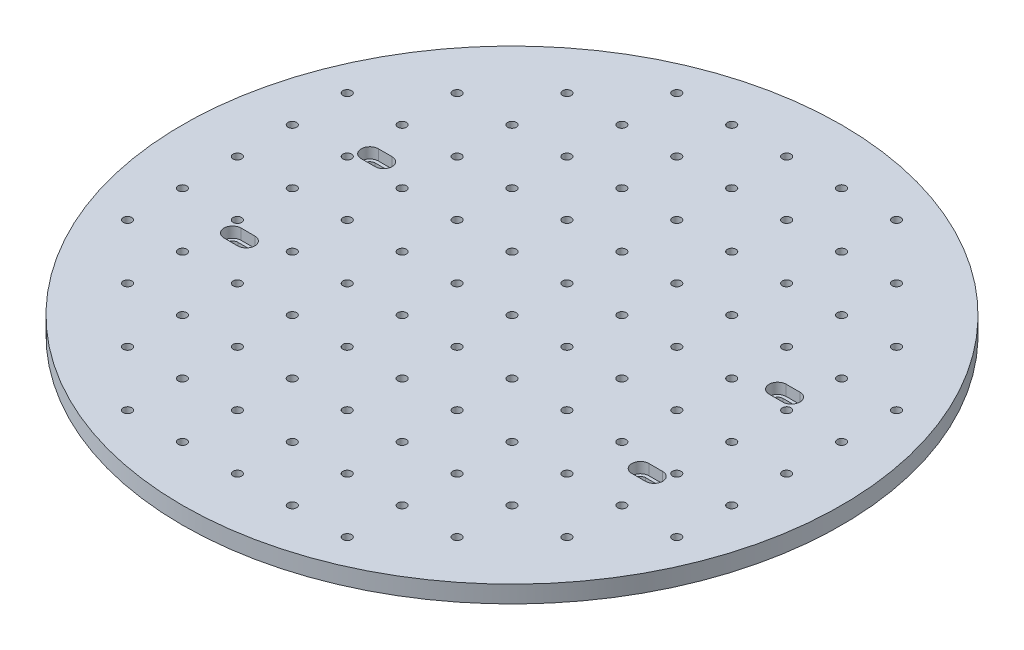
from build123d import *

# Parameters (mm, degrees)
SKETCH1_R      = 304.8
EXTRUDE1_DEPTH = 15.875
SKETCH2_R      = 3.96875
EXTRUDE2_DEPTH = 432.344520801
EXTRUDE3_DEPTH = 15.875
EXTRUDE4_DEPTH = 9.8298


with BuildPart() as part:
    # Sketch1 → Extrude1 (new body)
    with BuildSketch(Plane(origin=(0, 0, 0), x_dir=(1, 0, 0), z_dir=(0, 1, 0))):
        with Locations(Location((0, 0, 0), (0, 0, 270))):
            Circle(SKETCH1_R)
    extrude(amount=EXTRUDE1_DEPTH)

    # Sketch2 → Extrude2 (cut, through all)
    with BuildSketch(Plane(origin=(0, 15.875, 0), x_dir=(1, 0, 0), z_dir=(0, 1, 0))):
        with Locations(Location((-101.6, -254, 0), (0, 0, 270))):
            Circle(SKETCH2_R)
        with Locations(Location((-50.8, -254, 0), (0, 0, 270))):
            Circle(SKETCH2_R)
        with Locations(Location((0, -254, 0), (0, 0, 270))):
            Circle(SKETCH2_R)
        with Locations(Location((50.8, -254, 0), (0, 0, 270))):
            Circle(SKETCH2_R)
        with Locations(Location((101.6, -254, 0), (0, 0, 270))):
            Circle(SKETCH2_R)
        with Locations(Location((-152.4, -203.2, 0), (0, 0, 270))):
            Circle(SKETCH2_R)
        with Locations(Location((-101.6, -203.2, 0), (0, 0, 270))):
            Circle(SKETCH2_R)
        with Locations(Location((-50.8, -203.2, 0), (0, 0, 270))):
            Circle(SKETCH2_R)
        with Locations(Location((0, -203.2, 0), (0, 0, 270))):
            Circle(SKETCH2_R)
        with Locations(Location((50.8, -203.2, 0), (0, 0, 270))):
            Circle(SKETCH2_R)
        with Locations(Location((101.6, -203.2, 0), (0, 0, 270))):
            Circle(SKETCH2_R)
        with Locations(Location((152.4, -203.2, 0), (0, 0, 270))):
            Circle(SKETCH2_R)
        with Locations(Location((-203.2, -152.4, 0), (0, 0, 270))):
            Circle(SKETCH2_R)
        with Locations(Location((-152.4, -152.4, 0), (0, 0, 270))):
            Circle(SKETCH2_R)
        with Locations(Location((-101.6, -152.4, 0), (0, 0, 270))):
            Circle(SKETCH2_R)
        with Locations(Location((-50.8, -152.4, 0), (0, 0, 270))):
            Circle(SKETCH2_R)
        with Locations(Location((0, -152.4, 0), (0, 0, 270))):
            Circle(SKETCH2_R)
        with Locations(Location((50.8, -152.4, 0), (0, 0, 270))):
            Circle(SKETCH2_R)
        with Locations(Location((101.6, -152.4, 0), (0, 0, 270))):
            Circle(SKETCH2_R)
        with Locations(Location((152.4, -152.4, 0), (0, 0, 270))):
            Circle(SKETCH2_R)
        with Locations(Location((203.2, -152.4, 0), (0, 0, 270))):
            Circle(SKETCH2_R)
        with Locations(Location((-254, -101.6, 0), (0, 0, 270))):
            Circle(SKETCH2_R)
        with Locations(Location((-203.2, -101.6, 0), (0, 0, 270))):
            Circle(SKETCH2_R)
        with Locations(Location((-152.4, -101.6, 0), (0, 0, 270))):
            Circle(SKETCH2_R)
        with Locations(Location((-101.6, -101.6, 0), (0, 0, 270))):
            Circle(SKETCH2_R)
        with Locations(Location((-50.8, -101.6, 0), (0, 0, 270))):
            Circle(SKETCH2_R)
        with Locations(Location((0, -101.6, 0), (0, 0, 270))):
            Circle(SKETCH2_R)
        with Locations(Location((50.8, -101.6, 0), (0, 0, 270))):
            Circle(SKETCH2_R)
        with Locations(Location((101.6, -101.6, 0), (0, 0, 270))):
            Circle(SKETCH2_R)
        with Locations(Location((152.4, -101.6, 0), (0, 0, 270))):
            Circle(SKETCH2_R)
        with Locations(Location((203.2, -101.6, 0), (0, 0, 270))):
            Circle(SKETCH2_R)
        with Locations(Location((254, -101.6, 0), (0, 0, 270))):
            Circle(SKETCH2_R)
        with Locations(Location((-254, -50.8, 0), (0, 0, 270))):
            Circle(SKETCH2_R)
        with Locations(Location((-203.2, -50.8, 0), (0, 0, 270))):
            Circle(SKETCH2_R)
        with Locations(Location((-152.4, -50.8, 0), (0, 0, 270))):
            Circle(SKETCH2_R)
        with Locations(Location((-101.6, -50.8, 0), (0, 0, 270))):
            Circle(SKETCH2_R)
        with Locations(Location((-50.8, -50.8, 0), (0, 0, 270))):
            Circle(SKETCH2_R)
        with Locations(Location((0, -50.8, 0), (0, 0, 270))):
            Circle(SKETCH2_R)
        with Locations(Location((50.8, -50.8, 0), (0, 0, 270))):
            Circle(SKETCH2_R)
        with Locations(Location((101.6, -50.8, 0), (0, 0, 270))):
            Circle(SKETCH2_R)
        with Locations(Location((152.4, -50.8, 0), (0, 0, 270))):
            Circle(SKETCH2_R)
        with Locations(Location((203.2, -50.8, 0), (0, 0, 270))):
            Circle(SKETCH2_R)
        with Locations(Location((254, -50.8, 0), (0, 0, 270))):
            Circle(SKETCH2_R)
        with Locations(Location((-254, 0, 0), (0, 0, 270))):
            Circle(SKETCH2_R)
        with Locations(Location((-203.2, 0, 0), (0, 0, 270))):
            Circle(SKETCH2_R)
        with Locations(Location((-152.4, 0, 0), (0, 0, 270))):
            Circle(SKETCH2_R)
        with Locations(Location((-101.6, 0, 0), (0, 0, 270))):
            Circle(SKETCH2_R)
        with Locations(Location((-50.8, 0, 0), (0, 0, 270))):
            Circle(SKETCH2_R)
        with Locations(Location((0, 0, 0), (0, 0, 270))):
            Circle(SKETCH2_R)
        with Locations(Location((50.8, 0, 0), (0, 0, 270))):
            Circle(SKETCH2_R)
        with Locations(Location((101.6, 0, 0), (0, 0, 270))):
            Circle(SKETCH2_R)
        with Locations(Location((152.4, 0, 0), (0, 0, 270))):
            Circle(SKETCH2_R)
        with Locations(Location((203.2, 0, 0), (0, 0, 270))):
            Circle(SKETCH2_R)
        with Locations(Location((254, 0, 0), (0, 0, 270))):
            Circle(SKETCH2_R)
        with Locations(Location((-254, 50.8, 0), (0, 0, 270))):
            Circle(SKETCH2_R)
        with Locations(Location((-203.2, 50.8, 0), (0, 0, 270))):
            Circle(SKETCH2_R)
        with Locations(Location((-152.4, 50.8, 0), (0, 0, 270))):
            Circle(SKETCH2_R)
        with Locations(Location((-101.6, 50.8, 0), (0, 0, 270))):
            Circle(SKETCH2_R)
        with Locations(Location((-50.8, 50.8, 0), (0, 0, 270))):
            Circle(SKETCH2_R)
        with Locations(Location((0, 50.8, 0), (0, 0, 270))):
            Circle(SKETCH2_R)
        with Locations(Location((50.8, 50.8, 0), (0, 0, 270))):
            Circle(SKETCH2_R)
        with Locations(Location((101.6, 50.8, 0), (0, 0, 270))):
            Circle(SKETCH2_R)
        with Locations(Location((152.4, 50.8, 0), (0, 0, 270))):
            Circle(SKETCH2_R)
        with Locations(Location((203.2, 50.8, 0), (0, 0, 270))):
            Circle(SKETCH2_R)
        with Locations(Location((254, 50.8, 0), (0, 0, 270))):
            Circle(SKETCH2_R)
        with Locations(Location((-254, 101.6, 0), (0, 0, 270))):
            Circle(SKETCH2_R)
        with Locations(Location((-203.2, 101.6, 0), (0, 0, 270))):
            Circle(SKETCH2_R)
        with Locations(Location((-152.4, 101.6, 0), (0, 0, 270))):
            Circle(SKETCH2_R)
        with Locations(Location((-101.6, 101.6, 0), (0, 0, 270))):
            Circle(SKETCH2_R)
        with Locations(Location((-50.8, 101.6, 0), (0, 0, 270))):
            Circle(SKETCH2_R)
        with Locations(Location((0, 101.6, 0), (0, 0, 270))):
            Circle(SKETCH2_R)
        with Locations(Location((50.8, 101.6, 0), (0, 0, 270))):
            Circle(SKETCH2_R)
        with Locations(Location((101.6, 101.6, 0), (0, 0, 270))):
            Circle(SKETCH2_R)
        with Locations(Location((152.4, 101.6, 0), (0, 0, 270))):
            Circle(SKETCH2_R)
        with Locations(Location((203.2, 101.6, 0), (0, 0, 270))):
            Circle(SKETCH2_R)
        with Locations(Location((254, 101.6, 0), (0, 0, 270))):
            Circle(SKETCH2_R)
        with Locations(Location((-203.2, 152.4, 0), (0, 0, 270))):
            Circle(SKETCH2_R)
        with Locations(Location((-152.4, 152.4, 0), (0, 0, 270))):
            Circle(SKETCH2_R)
        with Locations(Location((-101.6, 152.4, 0), (0, 0, 270))):
            Circle(SKETCH2_R)
        with Locations(Location((-50.8, 152.4, 0), (0, 0, 270))):
            Circle(SKETCH2_R)
        with Locations(Location((0, 152.4, 0), (0, 0, 270))):
            Circle(SKETCH2_R)
        with Locations(Location((50.8, 152.4, 0), (0, 0, 270))):
            Circle(SKETCH2_R)
        with Locations(Location((101.6, 152.4, 0), (0, 0, 270))):
            Circle(SKETCH2_R)
        with Locations(Location((152.4, 152.4, 0), (0, 0, 270))):
            Circle(SKETCH2_R)
        with Locations(Location((203.2, 152.4, 0), (0, 0, 270))):
            Circle(SKETCH2_R)
        with Locations(Location((-152.4, 203.2, 0), (0, 0, 270))):
            Circle(SKETCH2_R)
        with Locations(Location((-101.6, 203.2, 0), (0, 0, 270))):
            Circle(SKETCH2_R)
        with Locations(Location((-50.8, 203.2, 0), (0, 0, 270))):
            Circle(SKETCH2_R)
        with Locations(Location((0, 203.2, 0), (0, 0, 270))):
            Circle(SKETCH2_R)
        with Locations(Location((50.8, 203.2, 0), (0, 0, 270))):
            Circle(SKETCH2_R)
        with Locations(Location((101.6, 203.2, 0), (0, 0, 270))):
            Circle(SKETCH2_R)
        with Locations(Location((152.4, 203.2, 0), (0, 0, 270))):
            Circle(SKETCH2_R)
        with Locations(Location((-101.6, 254, 0), (0, 0, 270))):
            Circle(SKETCH2_R)
        with Locations(Location((-50.8, 254, 0), (0, 0, 270))):
            Circle(SKETCH2_R)
        with Locations(Location((0, 254, 0), (0, 0, 270))):
            Circle(SKETCH2_R)
        with Locations(Location((50.8, 254, 0), (0, 0, 270))):
            Circle(SKETCH2_R)
        with Locations(Location((101.6, 254, 0), (0, 0, 270))):
            Circle(SKETCH2_R)
    extrude(amount=-EXTRUDE2_DEPTH, mode=Mode.SUBTRACT)

    # Sketch3 → Extrude3 (cut)
    with BuildSketch(Plane(origin=(0, 15.875, 0), x_dir=(1, 0, 0), z_dir=(0, 1, 0))):
        with BuildLine():
            Line((182.1942, 68.4022), (194.8942, 68.4022))
            ThreePointArc((194.8942, 68.4022), (199.7964, 63.5), (194.8942, 58.5978))
            Line((194.8942, 58.5978), (182.1942, 58.5978))
            ThreePointArc((182.1942, 58.5978), (177.292, 63.5), (182.1942, 68.4022))
        make_face()
        with BuildLine():
            Line((-194.9958, 68.4022), (-182.2958, 68.4022))
            ThreePointArc((-182.2958, 68.4022), (-177.3936, 63.5), (-182.2958, 58.5978))
            Line((-182.2958, 58.5978), (-194.9958, 58.5978))
            ThreePointArc((-194.9958, 58.5978), (-199.898, 63.5), (-194.9958, 68.4022))
        make_face()
        with BuildLine():
            Line((-194.9958, -58.5978), (-182.2958, -58.5978))
            ThreePointArc((-182.2958, -58.5978), (-177.3936, -63.5), (-182.2958, -68.4022))
            Line((-182.2958, -68.4022), (-194.9958, -68.4022))
            ThreePointArc((-194.9958, -68.4022), (-199.898, -63.5), (-194.9958, -58.5978))
        make_face()
        with BuildLine():
            Line((182.1942, -58.5978), (194.8942, -58.5978))
            ThreePointArc((194.8942, -58.5978), (199.7964, -63.5), (194.8942, -68.4022))
            Line((194.8942, -68.4022), (182.1942, -68.4022))
            ThreePointArc((182.1942, -68.4022), (177.292, -63.5), (182.1942, -58.5978))
        make_face()
    extrude(amount=-EXTRUDE3_DEPTH, mode=Mode.SUBTRACT)

    # Sketch4 → Extrude4 (cut)
    # profile 1 of 4: a face of its own
    with BuildSketch(Plane(origin=(0, 15.875, 0), x_dir=(1, 0, 0), z_dir=(0, 1, 0))):
        with BuildLine():
            Line((-182.2958, -55.5625), (-194.9958, -55.5625))
            ThreePointArc((-194.9958, -55.5625), (-202.9333, -63.5), (-194.9958, -71.4375))
            Line((-194.9958, -71.4375), (-182.2958, -71.4375))
            ThreePointArc((-182.2958, -71.4375), (-174.3583, -63.5), (-182.2958, -55.5625))
        make_face()
        with BuildLine():
            Line((-182.2958, -58.5978), (-194.9958, -58.5978))
            ThreePointArc((-194.9958, -58.5978), (-199.898, -63.5), (-194.9958, -68.4022))
            Line((-194.9958, -68.4022), (-182.2958, -68.4022))
            ThreePointArc((-182.2958, -68.4022), (-177.3936, -63.5), (-182.2958, -58.5978))
        make_face(mode=Mode.SUBTRACT)
    # profile 2 of 4: a face of its own
    with BuildSketch(Plane(origin=(0, 15.875, 0), x_dir=(1, 0, 0), z_dir=(0, 1, 0))):
        with BuildLine():
            Line((-182.2958, 71.4375), (-194.9958, 71.4375))
            ThreePointArc((-194.9958, 71.4375), (-202.9333, 63.5), (-194.9958, 55.5625))
            Line((-194.9958, 55.5625), (-182.2958, 55.5625))
            ThreePointArc((-182.2958, 55.5625), (-174.3583, 63.5), (-182.2958, 71.4375))
        make_face()
        with BuildLine():
            Line((-182.2958, 68.4022), (-194.9958, 68.4022))
            ThreePointArc((-194.9958, 68.4022), (-199.898, 63.5), (-194.9958, 58.5978))
            Line((-194.9958, 58.5978), (-182.2958, 58.5978))
            ThreePointArc((-182.2958, 58.5978), (-177.3936, 63.5), (-182.2958, 68.4022))
        make_face(mode=Mode.SUBTRACT)
    # profile 3 of 4: a face of its own
    with BuildSketch(Plane(origin=(0, 15.875, 0), x_dir=(1, 0, 0), z_dir=(0, 1, 0))):
        with BuildLine():
            Line((182.1942, -71.4375), (194.8942, -71.4375))
            ThreePointArc((194.8942, -71.4375), (202.8317, -63.5), (194.8942, -55.5625))
            Line((194.8942, -55.5625), (182.1942, -55.5625))
            ThreePointArc((182.1942, -55.5625), (174.2567, -63.5), (182.1942, -71.4375))
        make_face()
        with BuildLine():
            Line((182.1942, -68.4022), (194.8942, -68.4022))
            ThreePointArc((194.8942, -68.4022), (199.7964, -63.5), (194.8942, -58.5978))
            Line((194.8942, -58.5978), (182.1942, -58.5978))
            ThreePointArc((182.1942, -58.5978), (177.292, -63.5), (182.1942, -68.4022))
        make_face(mode=Mode.SUBTRACT)
    # profile 4 of 4: a face of its own
    with BuildSketch(Plane(origin=(0, 15.875, 0), x_dir=(1, 0, 0), z_dir=(0, 1, 0))):
        with BuildLine():
            Line((182.1942, 55.5625), (194.8942, 55.5625))
            ThreePointArc((194.8942, 55.5625), (202.8317, 63.5), (194.8942, 71.4375))
            Line((194.8942, 71.4375), (182.1942, 71.4375))
            ThreePointArc((182.1942, 71.4375), (174.2567, 63.5), (182.1942, 55.5625))
        make_face()
        with BuildLine():
            Line((182.1942, 58.5978), (194.8942, 58.5978))
            ThreePointArc((194.8942, 58.5978), (199.7964, 63.5), (194.8942, 68.4022))
            Line((194.8942, 68.4022), (182.1942, 68.4022))
            ThreePointArc((182.1942, 68.4022), (177.292, 63.5), (182.1942, 58.5978))
        make_face(mode=Mode.SUBTRACT)
    extrude(amount=-EXTRUDE4_DEPTH, mode=Mode.SUBTRACT)


solid = part.part
